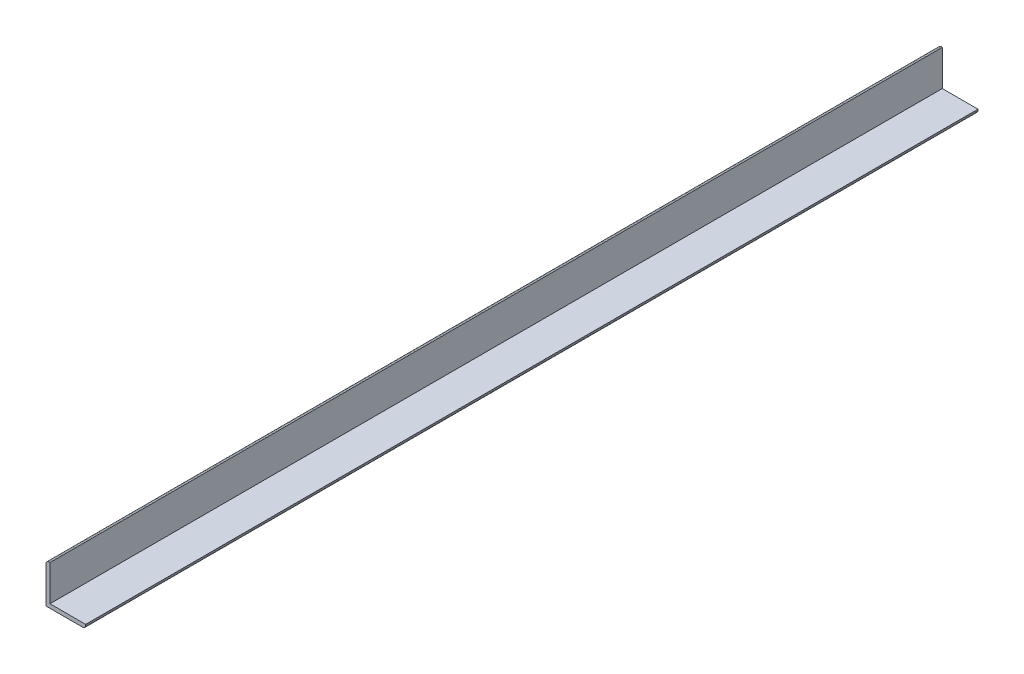
from build123d import *

# Parameters (mm, degrees)
EXTRUDE_1_DEPTH = 900


with BuildPart() as part:
    # Эскиз1 → Бобышка-Вытянуть1 (new body)
    with BuildSketch(Plane.XY):
        with BuildLine():
            Line((0, 0), (37, 0))
            ThreePointArc((37, 0), (39.121320344, 0.878679656), (40, 3))
            Line((40, 3), (40, 4))
            Line((40, 4), (4, 4))
            Line((4, 4), (4, 40))
            Line((4, 40), (3, 40))
            ThreePointArc((3, 40), (0.878679656, 39.121320344), (0, 37))
            Line((0, 37), (0, 0))
        make_face()
    extrude(amount=EXTRUDE_1_DEPTH)


solid = part.part
